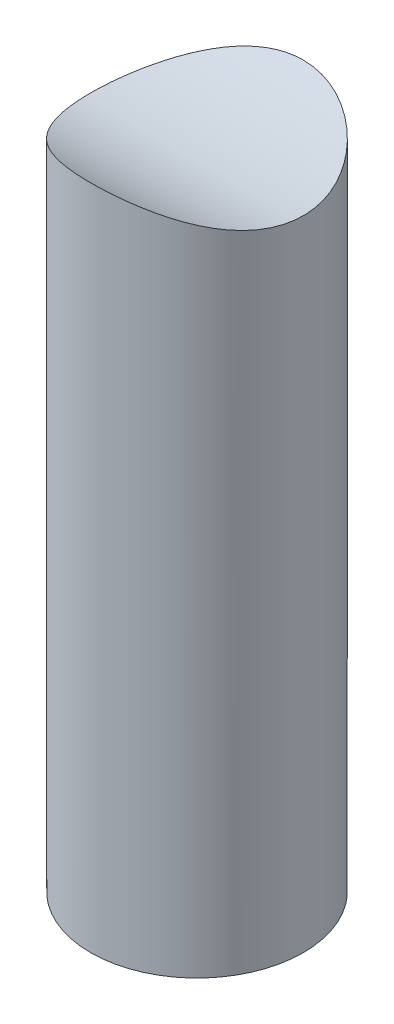
from build123d import *

# Parameters (mm, degrees)
CROQUIS1_R                 = 25
SALIENTE_EXTRUIR1_DEPTH    = 170
CORTAR_EXTRUIR1_DEPTH      = 174.637553542
CORTAR_EXTRUIR1_DEPTH_BACK = 174.637553542
CROQUIS5_R                 = 50


with BuildPart() as part:
    # Croquis1 → Saliente-Extruir1 (new body)
    with BuildSketch(Plane(origin=(0, 0, 0), x_dir=(1, 0, 0), z_dir=(0, 1, 0))):
        with Locations(Location((0, 0, 0), (0, 0, 270))):
            Circle(CROQUIS1_R)
    extrude(amount=SALIENTE_EXTRUIR1_DEPTH)

    # Croquis5 → Cortar-Extruir1 (cut, two sides: drawn at the far end of the back side and taken through both)
    with BuildSketch(Plane(origin=(0, 0, 0), x_dir=(0, 0, -1), z_dir=(1, 0, 0)).offset(-CORTAR_EXTRUIR1_DEPTH_BACK)):
        with Locations((0, 200)):
            Circle(CROQUIS5_R)
    extrude(amount=CORTAR_EXTRUIR1_DEPTH + CORTAR_EXTRUIR1_DEPTH_BACK, mode=Mode.SUBTRACT)


solid = part.part
